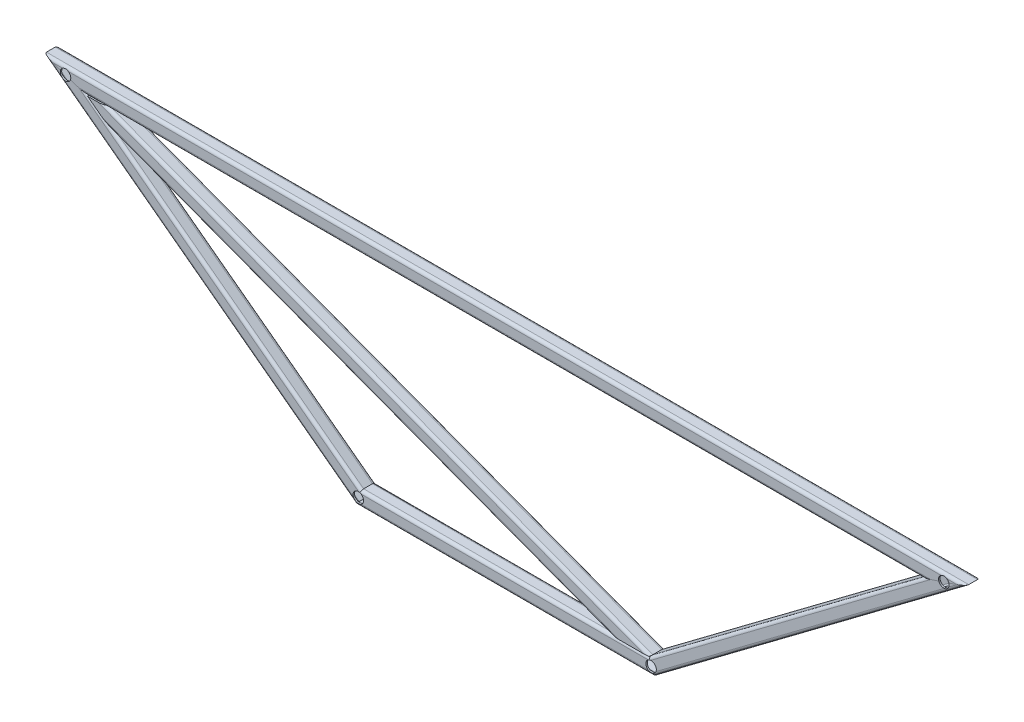
from build123d import *

# Parameters (mm, degrees)
SQUARE_TUBE_20_X_20_X_2_2_DEPTH      = 1243.426406871
SQUARE_TUBE_20_X_20_X_2_2_DEPTH_BACK = 43.426406871
SQUARE_TUBE_20_X_20_X_2_2_2_DEPTH    = 549.140452079
SQUARE_TUBE_20_X_20_X_2_2_3_DEPTH    = 411.428090416
SQUARE_TUBE_20_X_20_X_2_2_4_DEPTH    = 549.140452079
SQUARE_TUBE_20_X_20_X_2_1_DEPTH      = 854.400374532
SKETCH18_R                           = 7.19
CUT_EXTRUDE2_DEPTH                   = 703.424373155


with BuildPart() as part:
    # Sketch15 → Square tube 20 X 20 X 2(2) (new, two sides: drawn at the far end of the back side and taken through both)
    with BuildSketch(Plane(origin=(600, 0, 0), x_dir=(0, -1, 0), z_dir=(-1, 0, 0)).offset(-SQUARE_TUBE_20_X_20_X_2_2_DEPTH_BACK)):
        with BuildLine():
            Line((-6, -10), (6, -10))
            ThreePointArc((6, -10), (8.828427125, -8.828427125), (10, -6))
            Line((10, -6), (10, 6))
            ThreePointArc((10, 6), (8.828427125, 8.828427125), (6, 10))
            Line((6, 10), (-6, 10))
            ThreePointArc((-6, 10), (-8.828427125, 8.828427125), (-10, 6))
            Line((-10, 6), (-10, -6))
            ThreePointArc((-10, -6), (-8.828427125, -8.828427125), (-6, -10))
        make_face()
        with BuildLine():
            Line((-6, -8), (6, -8))
            ThreePointArc((6, -8), (7.414213562, -7.414213562), (8, -6))
            Line((8, -6), (8, 6))
            ThreePointArc((8, 6), (7.414213562, 7.414213562), (6, 8))
            Line((6, 8), (-6, 8))
            ThreePointArc((-6, 8), (-7.414213562, 7.414213562), (-8, 6))
            Line((-8, 6), (-8, -6))
            ThreePointArc((-8, -6), (-7.414213562, -7.414213562), (-6, -8))
        make_face(mode=Mode.SUBTRACT)
    extrude(amount=SQUARE_TUBE_20_X_20_X_2_2_DEPTH + SQUARE_TUBE_20_X_20_X_2_2_DEPTH_BACK)

    # Square tube 20 X 20 X 2(2) mitre 1
    split(bisect_by=Plane(origin=(600, 0, 0), x_dir=(-0.948683298, -0.316227766, 0), z_dir=(-0.316227766, 0.948683298, 0)), keep=Keep.TOP)

    # Square tube 20 X 20 X 2(2) mitre 2
    split(bisect_by=Plane(origin=(-600, 0, 0), x_dir=(-0.948683298, 0.316227766, 0), z_dir=(0.316227766, 0.948683298, 0)), keep=Keep.TOP)


with BuildPart() as body_2:
    # Sketch15 on segment 2 (carried to segment 2) → Square tube 20 X 20 X 2_2 2 (new body)
    with BuildSketch(Plane(origin=(-634.741125497, 26.055844123, 0), x_dir=(0.6, 0.8, 0), z_dir=(0.8, -0.6, 0))):
        with BuildLine():
            Line((-6, -10), (6, -10))
            ThreePointArc((6, -10), (8.828427125, -8.828427125), (10, -6))
            Line((10, -6), (10, 6))
            ThreePointArc((10, 6), (8.828427125, 8.828427125), (6, 10))
            Line((6, 10), (-6, 10))
            ThreePointArc((-6, 10), (-8.828427125, 8.828427125), (-10, 6))
            Line((-10, 6), (-10, -6))
            ThreePointArc((-10, -6), (-8.828427125, -8.828427125), (-6, -10))
        make_face()
        with BuildLine():
            Line((-6, -8), (6, -8))
            ThreePointArc((6, -8), (7.414213562, -7.414213562), (8, -6))
            Line((8, -6), (8, 6))
            ThreePointArc((8, 6), (7.414213562, 7.414213562), (6, 8))
            Line((6, 8), (-6, 8))
            ThreePointArc((-6, 8), (-7.414213562, 7.414213562), (-8, 6))
            Line((-8, 6), (-8, -6))
            ThreePointArc((-8, -6), (-7.414213562, -7.414213562), (-6, -8))
        make_face(mode=Mode.SUBTRACT)
    extrude(amount=SQUARE_TUBE_20_X_20_X_2_2_2_DEPTH)

    # Square tube 20 X 20 X 2_2 2 mitre 1
    split(bisect_by=Plane(origin=(-600, 0, 0), x_dir=(0.948683298, -0.316227766, 0), z_dir=(-0.316227766, -0.948683298, 0)), keep=Keep.TOP)

    # Square tube 20 X 20 X 2_2 2 mitre 2
    split(bisect_by=Plane(origin=(-200, -300, 0), x_dir=(-0.316227766, -0.948683298, 0), z_dir=(-0.948683298, 0.316227766, 0)), keep=Keep.TOP)


with BuildPart() as body_3:
    # Sketch15 on segment 3 (carried to segment 3) → Square tube 20 X 20 X 2_2 3 (new body)
    with BuildSketch(Plane(origin=(-205.714045208, -300, 0), x_dir=(0, 1, 0), z_dir=(1, 0, 0))):
        with BuildLine():
            Line((-6, -10), (6, -10))
            ThreePointArc((6, -10), (8.828427125, -8.828427125), (10, -6))
            Line((10, -6), (10, 6))
            ThreePointArc((10, 6), (8.828427125, 8.828427125), (6, 10))
            Line((6, 10), (-6, 10))
            ThreePointArc((-6, 10), (-8.828427125, 8.828427125), (-10, 6))
            Line((-10, 6), (-10, -6))
            ThreePointArc((-10, -6), (-8.828427125, -8.828427125), (-6, -10))
        make_face()
        with BuildLine():
            Line((-6, -8), (6, -8))
            ThreePointArc((6, -8), (7.414213562, -7.414213562), (8, -6))
            Line((8, -6), (8, 6))
            ThreePointArc((8, 6), (7.414213562, 7.414213562), (6, 8))
            Line((6, 8), (-6, 8))
            ThreePointArc((-6, 8), (-7.414213562, 7.414213562), (-8, 6))
            Line((-8, 6), (-8, -6))
            ThreePointArc((-8, -6), (-7.414213562, -7.414213562), (-6, -8))
        make_face(mode=Mode.SUBTRACT)
    extrude(amount=SQUARE_TUBE_20_X_20_X_2_2_3_DEPTH)

    # Square tube 20 X 20 X 2_2 3 mitre 1
    split(bisect_by=Plane(origin=(-200, -300, 0), x_dir=(0.316227766, 0.948683298, 0), z_dir=(0.948683298, -0.316227766, 0)), keep=Keep.TOP)

    # Square tube 20 X 20 X 2_2 3 mitre 2
    split(bisect_by=Plane(origin=(200, -300, 0), x_dir=(0.316227766, -0.948683298, 0), z_dir=(-0.948683298, -0.316227766, 0)), keep=Keep.TOP)


with BuildPart() as body_4:
    # Sketch15 on segment 4 (carried to segment 4) → Square tube 20 X 20 X 2_2 4 (new body)
    with BuildSketch(Plane(origin=(195.428763834, -303.428427125, 0), x_dir=(-0.6, 0.8, 0), z_dir=(0.8, 0.6, 0))):
        with BuildLine():
            Line((-6, -10), (6, -10))
            ThreePointArc((6, -10), (8.828427125, -8.828427125), (10, -6))
            Line((10, -6), (10, 6))
            ThreePointArc((10, 6), (8.828427125, 8.828427125), (6, 10))
            Line((6, 10), (-6, 10))
            ThreePointArc((-6, 10), (-8.828427125, 8.828427125), (-10, 6))
            Line((-10, 6), (-10, -6))
            ThreePointArc((-10, -6), (-8.828427125, -8.828427125), (-6, -10))
        make_face()
        with BuildLine():
            Line((-6, -8), (6, -8))
            ThreePointArc((6, -8), (7.414213562, -7.414213562), (8, -6))
            Line((8, -6), (8, 6))
            ThreePointArc((8, 6), (7.414213562, 7.414213562), (6, 8))
            Line((6, 8), (-6, 8))
            ThreePointArc((-6, 8), (-7.414213562, 7.414213562), (-8, 6))
            Line((-8, 6), (-8, -6))
            ThreePointArc((-8, -6), (-7.414213562, -7.414213562), (-6, -8))
        make_face(mode=Mode.SUBTRACT)
    extrude(amount=SQUARE_TUBE_20_X_20_X_2_2_4_DEPTH)

    # Square tube 20 X 20 X 2_2 4 mitre 1
    split(bisect_by=Plane(origin=(200, -300, 0), x_dir=(-0.316227766, 0.948683298, 0), z_dir=(0.948683298, 0.316227766, 0)), keep=Keep.TOP)

    # Square tube 20 X 20 X 2_2 4 mitre 2
    split(bisect_by=Plane(origin=(600, 0, 0), x_dir=(0.948683298, 0.316227766, 0), z_dir=(0.316227766, -0.948683298, 0)), keep=Keep.TOP)


with BuildPart() as body_5:
    # Sketch16 → Square tube 20 X 20 X 2(1) (new body)
    with BuildSketch(Plane(origin=(-600, 0, 0), x_dir=(0.35112344158839154, 0.9363291775690447, 0), z_dir=(0.9363291775690447, -0.35112344158839154, 0))):
        with BuildLine():
            Line((-6, -10), (6, -10))
            ThreePointArc((6, -10), (8.828427125, -8.828427125), (10, -6))
            Line((10, -6), (10, 6))
            ThreePointArc((10, 6), (8.828427125, 8.828427125), (6, 10))
            Line((6, 10), (-6, 10))
            ThreePointArc((-6, 10), (-8.828427125, 8.828427125), (-10, 6))
            Line((-10, 6), (-10, -6))
            ThreePointArc((-10, -6), (-8.828427125, -8.828427125), (-6, -10))
        make_face()
        with BuildLine():
            Line((-6, -8), (6, -8))
            ThreePointArc((6, -8), (7.414213562, -7.414213562), (8, -6))
            Line((8, -6), (8, 6))
            ThreePointArc((8, 6), (7.414213562, 7.414213562), (6, 8))
            Line((6, 8), (-6, 8))
            ThreePointArc((-6, 8), (-7.414213562, 7.414213562), (-8, 6))
            Line((-8, 6), (-8, -6))
            ThreePointArc((-8, -6), (-7.414213562, -7.414213562), (-6, -8))
        make_face(mode=Mode.SUBTRACT)
    extrude(amount=SQUARE_TUBE_20_X_20_X_2_1_DEPTH)

    # Trim/Extend1
    split(bisect_by=Plane.XZ.offset(10), keep=Keep.TOP)

    # Trim_Extend1 3
    split(bisect_by=Plane(origin=(-383.333333333, -150, 0), x_dir=(-0.8, 0.6, 0), z_dir=(0.6, 0.8, 0)), keep=Keep.TOP)

    # Trim_Extend1 5
    split(bisect_by=Plane(origin=(383.333333334, -150, 0), x_dir=(-0.8, -0.6, 0), z_dir=(-0.6, 0.8, 0)), keep=Keep.TOP)

    # Trim_Extend1 7
    split(bisect_by=Plane(origin=(0, -290, 0), x_dir=(-1, 0, 0), z_dir=(0, 1, 0)), keep=Keep.TOP)


with BuildPart() as cut_extrude2_tool:
    # Sketch18 → Cut-Extrude2 (new, through all)
    with BuildSketch(Plane.XY.offset(10)):
        with Locations((-600, 0)):
            Circle(SKETCH18_R)
        with Locations((-200, -300)):
            Circle(SKETCH18_R)
        with Locations((200, -300)):
            Circle(SKETCH18_R)
        with Locations((600, 0)):
            Circle(SKETCH18_R)
    extrude(amount=-CUT_EXTRUDE2_DEPTH)


with BuildPart() as part_1:
    add(part.part)

    # Cut-Extrude2: cut by cut_extrude2_tool
    add(cut_extrude2_tool.part, mode=Mode.SUBTRACT)


with BuildPart() as body_2_1:
    add(body_2.part)

    # Cut-Extrude2: cut by cut_extrude2_tool
    add(cut_extrude2_tool.part, mode=Mode.SUBTRACT)


with BuildPart() as body_3_1:
    add(body_3.part)

    # Cut-Extrude2: cut by cut_extrude2_tool
    add(cut_extrude2_tool.part, mode=Mode.SUBTRACT)


with BuildPart() as body_4_1:
    add(body_4.part)

    # Cut-Extrude2: cut by cut_extrude2_tool
    add(cut_extrude2_tool.part, mode=Mode.SUBTRACT)


solid = Compound([body_5.part, part_1.part, body_2_1.part, body_3_1.part, body_4_1.part])
